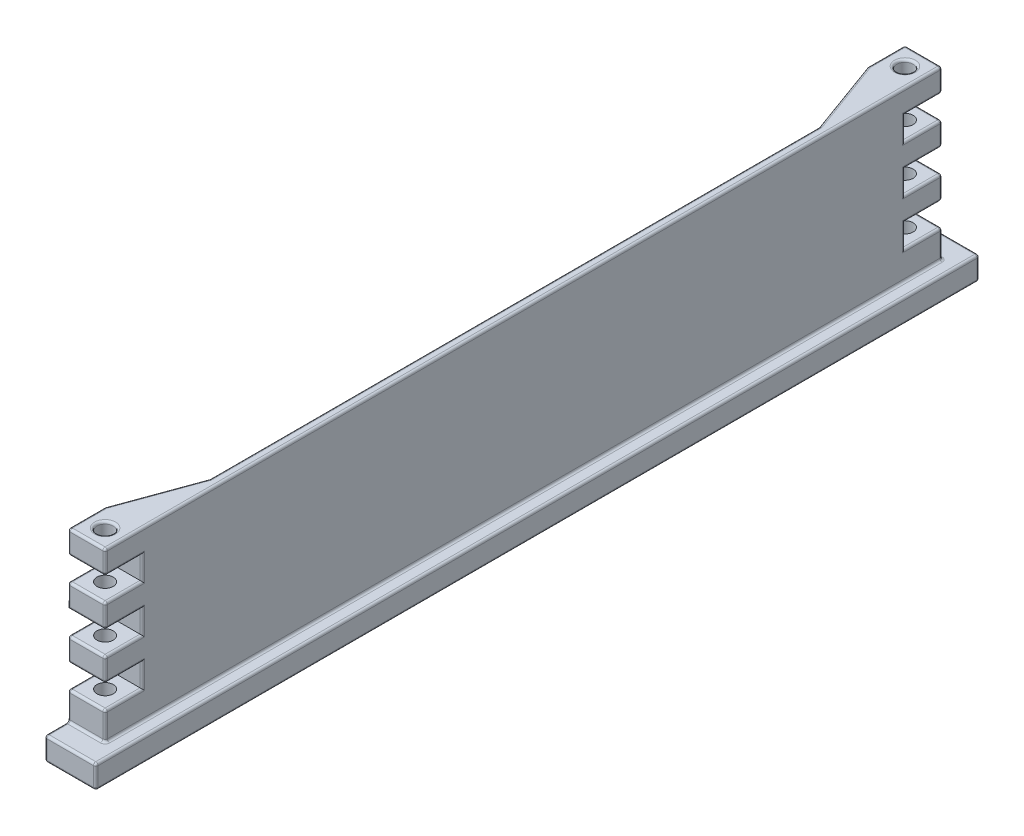
from build123d import *

# Parameters (mm, degrees)
BOSS_EXTRUDE1_DEPTH     = 8
CUT_EXTRUDE3_DEPTH      = 66.153664517
CUT_EXTRUDE3_DEPTH_BACK = 66.153664517
SKETCH7_R               = 1.75
SKETCH3_W               = 95
SKETCH3_H               = 5
BOSS_EXTRUDE2_DEPTH     = 3
CUT_EXTRUDE4_DEPTH      = 66.589633327
CUT_EXTRUDE4_DEPTH_BACK = 8
SKETCH7_3_R             = 1.75
CUT_EXTRUDE5_DEPTH      = 39
FILLET1_R               = 0.5


with BuildPart() as part:
    # Sketch1 → Boss-Extrude1 (new body)
    with BuildSketch(Plane(origin=(0, 0, 0), x_dir=(0, 0, -1), z_dir=(1, 0, 0))):
        Polygon((-50, -20.5), (-45, -20.5), (45, -20.5), (45, 20.5), (-37, 20.5), (-45, 20.5), (-45, 15.5), (-37, 15.5), (-37, 10.5), (-45, 10.5), (-45, 5.5), (-37, 5.5), (-37, 0.5), (-45, 0.5), (-45, -4.5), (-37, -4.5), (-37, -9.5), (-45, -9.5), (-45, -15.5), (-50, -15.5), align=None)
    extrude(amount=BOSS_EXTRUDE1_DEPTH)

    # Sketch7 → Cut-Extrude3 (cut, two sides: drawn at the far end of the back side and taken through both)
    with BuildSketch(Plane.XZ.offset(20.5).offset(-CUT_EXTRUDE3_DEPTH_BACK)):
        with Locations((4, 41)):
            Circle(SKETCH7_R)
    extrude(amount=CUT_EXTRUDE3_DEPTH + CUT_EXTRUDE3_DEPTH_BACK, mode=Mode.SUBTRACT)

    # Sketch3 → Boss-Extrude2 (add)
    with BuildSketch(Plane(origin=(8, 0, 0), x_dir=(0, 0, -1), z_dir=(1, 0, 0))):
        with Locations((-2.5, -18)):
            Rectangle(SKETCH3_W, SKETCH3_H)
    extrude(amount=BOSS_EXTRUDE2_DEPTH)

    # Sketch7<3> → Cut-Extrude4 (cut, two sides: drawn at the far end of the back side and taken through both)
    with BuildSketch(Plane.XZ.offset(20.5).offset(-CUT_EXTRUDE4_DEPTH_BACK)):
        Polygon((1.175, 42.63101451), (1.175, 39.36898549), (4, 37.737970979), (6.825, 39.36898549), (6.825, 42.63101451), (4, 44.262029021), align=None)
        with Locations((4, 41)):
            Circle(SKETCH7_3_R, mode=Mode.SUBTRACT)
    extrude(amount=CUT_EXTRUDE4_DEPTH + CUT_EXTRUDE4_DEPTH_BACK, mode=Mode.SUBTRACT)

    # Sketch8 → Cut-Extrude5 (cut)
    with BuildSketch(Plane(origin=(0, 20.5, 0), x_dir=(1, 0, 0), z_dir=(0, 1, 0))):
        Polygon((0, -37), (6, -20.515135483), (6, 45), (0, 45), align=None)
    extrude(amount=-CUT_EXTRUDE5_DEPTH, mode=Mode.SUBTRACT)

    # Mirror2: part across plane


with BuildPart() as part_1:
    add(part.part)
    add(part.part.mirror(Plane(origin=(8, 0, -45), x_dir=(1, 0, 0), z_dir=(0, 0, 1))))

    # Fillet1
    fillet1_edges = [part_1.edges().sort_by_distance(p)[0] for p in [
        (4, -9.5, 45),
        (4, -15.5, 45),
        (0, -12.5, 45),
        (5.5, -15.5, 50),
        (5.5, -20.5, 50),
        (0, -18, 50),
        (5.5, -20.5, -140),
        (5.5, -15.5, -140),
        (0, -18, -140),
        (4, -15.5, -135),
        (4, -9.5, -135),
        (0, -12.5, -135),
        (4, -4.5, -135),
        (4, 0.5, -135),
        (0, -2, -135),
        (4, 5.5, -135),
        (4, 10.5, -135),
        (0, 8, -135),
        (4, 15.5, -135),
        (0, 18, -135),
        (4, 15.5, 45),
        (0, 18, 45),
        (4, 10.5, 45),
        (4, 5.5, 45),
        (0, 8, 45),
        (4, 0.5, 45),
        (4, -4.5, 45),
        (0, -2, 45),
        (6, 1, 20.515135483),
        (6, 1, -110.515135483),
        (8, -9.5, 41),
        (8, -7, 37),
        (8, -4.5, 41),
        (8, -2, 45),
        (8, 0.5, 41),
        (8, 3, 37),
        (8, 5.5, 41),
        (8, 8, 45),
        (8, 10.5, 41),
        (8, 13, 37),
        (8, 15.5, 41),
        (8, 18, 45),
        (8, 18, -135),
        (8, 15.5, -131),
        (8, 13, -127),
        (8, 10.5, -131),
        (8, 8, -135),
        (8, 5.5, -131),
        (8, 3, -127),
        (8, 0.5, -131),
        (8, -2, -135),
        (8, -4.5, -131),
        (8, -7, -127),
        (8, -9.5, -131),
        (8, -12.5, -135),
        (8, -15.5, -45),
        (8, -12.5, 45),
        (2.25, 20.5, -131),
        (2.25, 20.5, 41),
        (6, 20.5, -45),
        (3, 20.5, -118.757567742),
        (0, 20.5, -131),
        (4, 20.5, -135),
        (8, 20.5, -45),
        (4, 20.5, 45),
        (0, 20.5, 41),
        (3, 20.5, 28.757567742),
        (0, -4.5, 41),
        (0, 0.5, 41),
        (0, 10.5, 41),
        (0, 15.5, 41),
        (0, -9.5, 41),
        (0, -15.5, 47.5),
        (0, 15.5, -131),
        (0, 10.5, -131),
        (0, 5.5, -131),
        (0, -4.5, -131),
        (0, 0.5, -131),
        (0, -9.5, -131),
        (0, -15.5, -137.5),
        (0, -20.5, -45),
        (6, -18.5, -45),
        (0, -18.5, -45),
        (11, -18, 50),
        (11, -18, -140),
        (11, -20.5, -45),
        (11, -15.5, -45),
    ]]
    fillet(fillet1_edges, radius=FILLET1_R)


solid = part_1.part
